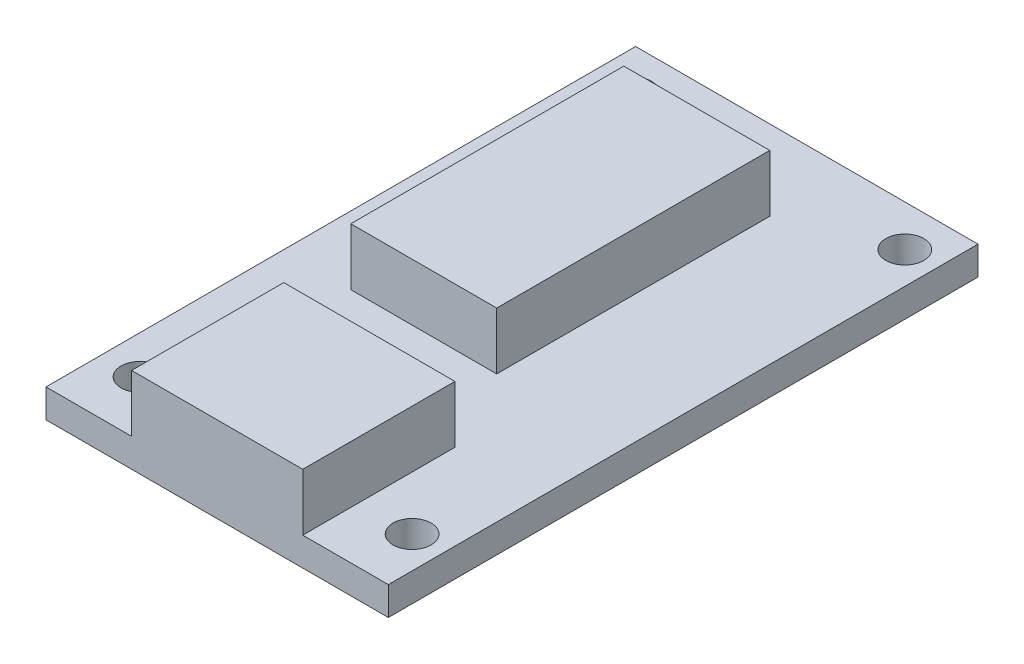
from build123d import *

# Parameters (mm, degrees)
SKETCH1_W           = 9
SKETCH1_H           = 8
BOSS_EXTRUDE1_DEPTH = 1.5
SKETCH1_3_W         = 9
SKETCH1_3_H         = 8
BOSS_EXTRUDE2_DEPTH = 4.5
SKETCH2_W           = 7.673510846
SKETCH2_H           = 14.355500628
BOSS_EXTRUDE3_DEPTH = 3
CUT_EXTRUDE1_DEPTH  = 10


with BuildPart() as part:
    # Sketch1 → Boss-Extrude1 (new body)
    with BuildSketch(Plane(origin=(0, 0, 0), x_dir=(1, 0, 0), z_dir=(0, 1, 0))):
        Polygon((0, 31), (0, 0), (4.5, 0), (4.5, 8), (13.5, 8), (13.5, 0), (18, 0), (18, 31), align=None)
        with Locations((9, 4)):
            Rectangle(SKETCH1_W, SKETCH1_H)
    extrude(amount=BOSS_EXTRUDE1_DEPTH)

    # Sketch1<3> → Boss-Extrude2 (add)
    with BuildSketch(Plane(origin=(0, 0, 0), x_dir=(1, 0, 0), z_dir=(0, 1, 0))):
        with Locations((9, 4)):
            Rectangle(SKETCH1_3_W, SKETCH1_3_H)
    extrude(amount=BOSS_EXTRUDE2_DEPTH)

    # Sketch2 → Boss-Extrude3 (add)
    with BuildSketch(Plane(origin=(0, 1.5, 0), x_dir=(1, 0, 0), z_dir=(0, 1, 0))):
        with Locations((7.420466752, 19.616967898)):
            Rectangle(SKETCH2_W, SKETCH2_H)
    extrude(amount=BOSS_EXTRUDE3_DEPTH)

    # Sketch3 → Cut-Extrude1 (cut)
    with BuildSketch(Plane(origin=(0, 1.5, 0), x_dir=(1, 0, 0), z_dir=(0, 1, 0))):
        with BuildLine():
            ThreePointArc((3.017303644, 2.926927408), (2.724410426, 3.634034189), (2.017303644, 3.926927408))
            Line((2.017303644, 3.926927408), (2.017303644, 2.926927408))
            Line((2.017303644, 2.926927408), (3.017303644, 2.926927408))
        make_face()
        with BuildLine():
            Line((2.017303644, 2.926927408), (2.017303644, 3.926927408))
            ThreePointArc((2.017303644, 3.926927408), (1.310196863, 2.219820627), (3.017303644, 2.926927408))
            Line((3.017303644, 2.926927408), (2.017303644, 2.926927408))
        make_face()
        with BuildLine():
            ThreePointArc((17.320228506, 2.926927408), (17.027335287, 3.634034189), (16.320228506, 3.926927408))
            Line((16.320228506, 3.926927408), (16.320228506, 2.926927408))
            Line((16.320228506, 2.926927408), (15.320228506, 2.926927408))
            ThreePointArc((15.320228506, 2.926927408), (16.320228506, 1.926927408), (17.320228506, 2.926927408))
        make_face()
        with BuildLine():
            Line((16.320228506, 2.926927408), (16.320228506, 3.926927408))
            ThreePointArc((16.320228506, 3.926927408), (15.613121724, 3.634034189), (15.320228506, 2.926927408))
            Line((15.320228506, 2.926927408), (16.320228506, 2.926927408))
        make_face()
        with BuildLine():
            Line((2.017303644, 27.83251993), (2.017303644, 28.83251993))
            Line((2.017303644, 28.83251993), (3.017303644, 28.83251993))
            ThreePointArc((3.017303644, 28.83251993), (1.310196863, 29.539626711), (2.017303644, 27.83251993))
        make_face()
        with BuildLine():
            Line((3.017303644, 28.83251993), (2.017303644, 28.83251993))
            Line((2.017303644, 28.83251993), (2.017303644, 27.83251993))
            ThreePointArc((2.017303644, 27.83251993), (2.724410426, 28.125413148), (3.017303644, 28.83251993))
        make_face()
        with BuildLine():
            ThreePointArc((17.320228506, 28.83251993), (16.320228506, 29.83251993), (15.320228506, 28.83251993))
            Line((15.320228506, 28.83251993), (16.320228506, 28.83251993))
            Line((16.320228506, 28.83251993), (16.320228506, 27.83251993))
            ThreePointArc((16.320228506, 27.83251993), (17.027335287, 28.125413148), (17.320228506, 28.83251993))
        make_face()
        with BuildLine():
            Line((16.320228506, 28.83251993), (15.320228506, 28.83251993))
            ThreePointArc((15.320228506, 28.83251993), (15.613121724, 28.125413148), (16.320228506, 27.83251993))
            Line((16.320228506, 27.83251993), (16.320228506, 28.83251993))
        make_face()
    extrude(amount=-CUT_EXTRUDE1_DEPTH, mode=Mode.SUBTRACT)


solid = part.part
